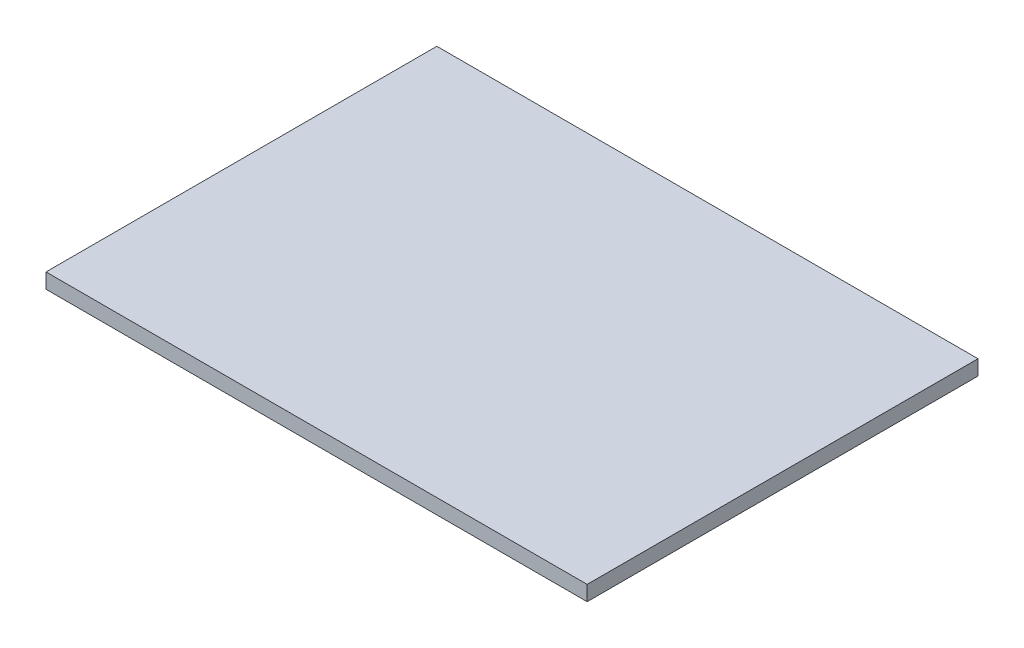
from build123d import *

# Parameters (mm, degrees)
SKETCH2_W           = 180
SKETCH2_H           = 130
BOSS_EXTRUDE1_DEPTH = 5


with BuildPart() as part:
    # Sketch2 → Boss-Extrude1 (new body)
    with BuildSketch(Plane(origin=(0, 0, 0), x_dir=(1, 0, 0), z_dir=(0, 1, 0))):
        with Locations((90, -65)):
            Rectangle(SKETCH2_W, SKETCH2_H)
    extrude(amount=BOSS_EXTRUDE1_DEPTH)


solid = part.part
